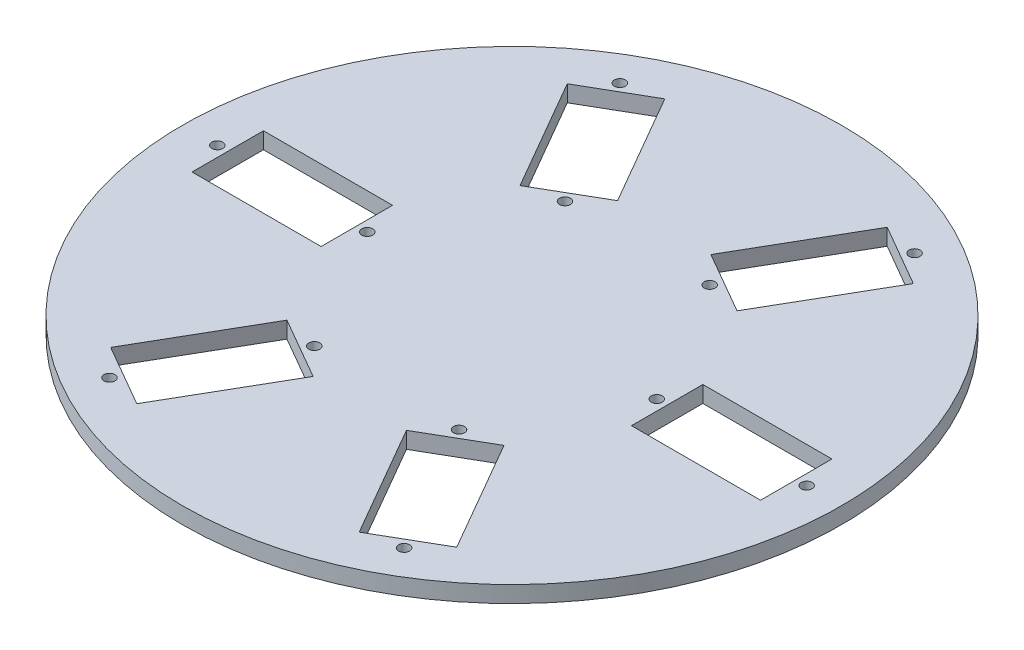
from build123d import *

# Parameters (mm, degrees)
SKETCH1_R           = 60
SKETCH1_R_2         = 1
SKETCH1_W           = 23.5
SKETCH1_H           = 13
BOSS_EXTRUDE1_DEPTH = 3


with BuildPart() as part:
    # Sketch1 → Boss-Extrude1 (new body)
    with BuildSketch(Plane(origin=(0, 0, 0), x_dir=(1, 0, 0), z_dir=(0, 1, 0))):
        with Locations(Location((0, 0, 0), (0, 0, 270))):
            Circle(SKETCH1_R)
        with Locations(Location((26.35, 0, 0), (0, 0, 270))):
            Circle(SKETCH1_R_2, mode=Mode.SUBTRACT)
        with Locations(Location((53.65, 0, 0), (0, 0, 270))):
            Circle(SKETCH1_R_2, mode=Mode.SUBTRACT)
        with Locations(Location((13.175, -22.81976939, 0), (0, 0, 270))):
            Circle(SKETCH1_R_2, mode=Mode.SUBTRACT)
        with Locations(Location((26.825, -46.462262913, 0), (0, 0, 270))):
            Circle(SKETCH1_R_2, mode=Mode.SUBTRACT)
        with Locations(Location((-13.175, -22.81976939, 0), (0, 0, 270))):
            Circle(SKETCH1_R_2, mode=Mode.SUBTRACT)
        with Locations(Location((-26.825, -46.462262913, 0), (0, 0, 270))):
            Circle(SKETCH1_R_2, mode=Mode.SUBTRACT)
        with Locations(Location((-26.35, 0, 0), (0, 0, 270))):
            Circle(SKETCH1_R_2, mode=Mode.SUBTRACT)
        with Locations(Location((-53.65, 0, 0), (0, 0, 270))):
            Circle(SKETCH1_R_2, mode=Mode.SUBTRACT)
        with Locations(Location((-13.175, 22.81976939, 0), (0, 0, 270))):
            Circle(SKETCH1_R_2, mode=Mode.SUBTRACT)
        with Locations(Location((-26.825, 46.462262913, 0), (0, 0, 270))):
            Circle(SKETCH1_R_2, mode=Mode.SUBTRACT)
        with Locations(Location((13.175, 22.81976939, 0), (0, 0, 270))):
            Circle(SKETCH1_R_2, mode=Mode.SUBTRACT)
        with Locations(Location((26.825, 46.462262913, 0), (0, 0, 270))):
            Circle(SKETCH1_R_2, mode=Mode.SUBTRACT)
        with Locations((40, 0)):
            Rectangle(SKETCH1_W, SKETCH1_H, mode=Mode.SUBTRACT)
        Polygon((8.495834875, -27.715217657), (19.754165125, -21.215217657), (31.504165125, -41.566814646), (20.245834875, -48.066814646), align=None, mode=Mode.SUBTRACT)
        Polygon((-19.754165125, -21.215217657), (-8.495834875, -27.715217657), (-20.245834875, -48.066814646), (-31.504165125, -41.566814646), align=None, mode=Mode.SUBTRACT)
        with Locations((-40, 0)):
            Rectangle(SKETCH1_W, SKETCH1_H, mode=Mode.SUBTRACT)
        Polygon((-8.495834875, 27.715217657), (-19.754165125, 21.215217657), (-31.504165125, 41.566814646), (-20.245834875, 48.066814646), align=None, mode=Mode.SUBTRACT)
        Polygon((19.754165125, 21.215217657), (8.495834875, 27.715217657), (20.245834875, 48.066814646), (31.504165125, 41.566814646), align=None, mode=Mode.SUBTRACT)
    extrude(amount=BOSS_EXTRUDE1_DEPTH)


solid = part.part
